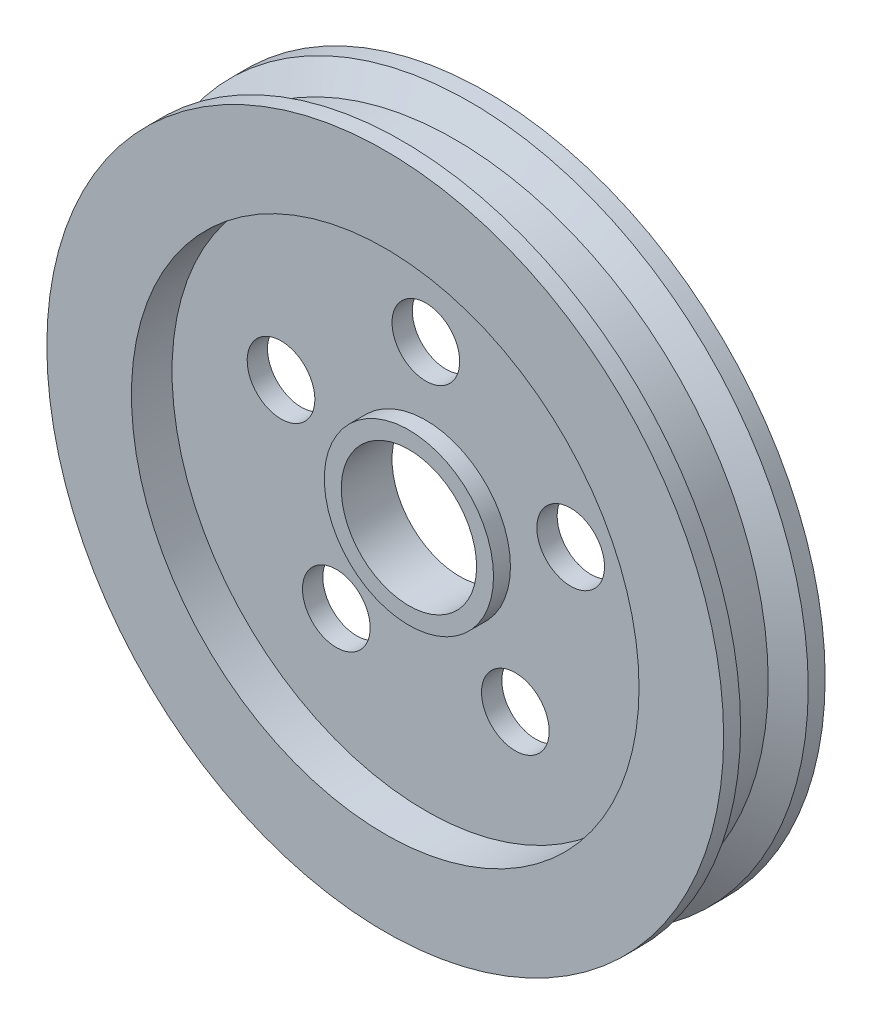
from build123d import *

# Parameters (mm, degrees)
SKETCH1_R                = 20
SKETCH1_R_2              = 4
BOSS_EXTRUDE1_DEPTH      = 3
SKETCH3_R                = 15
CUT_EXTRUDE1_DEPTH       = 2.4
SKETCH4_R                = 2
CUT_EXTRUDE2_DEPTH       = 29.51245342
CIRPATTERN1_COUNT        = 5
BOSS_EXTRUDE3_DEPTH      = 1
BOSS_EXTRUDE3_DEPTH_BACK = 2
SKETCH14_R               = 5
SKETCH16_R               = 4
CUT_EXTRUDE3_DEPTH       = 29.655889447


with BuildPart() as part:
    # Sketch1 → Boss-Extrude1 (new, symmetric)
    with BuildSketch(Plane.XY):
        Circle(SKETCH1_R)
        Circle(SKETCH1_R_2, mode=Mode.SUBTRACT)
    extrude(amount=BOSS_EXTRUDE1_DEPTH, both=True)

    # Sketch3 → Cut-Extrude1 (cut)
    with BuildSketch(Plane.XY.offset(3)):
        Circle(SKETCH3_R)
    cut_extrude1 = extrude(amount=-CUT_EXTRUDE1_DEPTH, mode=Mode.SUBTRACT)

    # Mirror1: Cut-Extrude1 across plane
    add(cut_extrude1.mirror(Plane.XY), mode=Mode.SUBTRACT)

    # Sketch4 → Cut-Extrude2 (cut, through all)
    with BuildSketch(Plane.XY.offset(0.6)):
        with Locations((0, 9)):
            Circle(SKETCH4_R)
    cut_extrude2 = extrude(amount=-CUT_EXTRUDE2_DEPTH, mode=Mode.SUBTRACT)

    # CirPattern1: Cut-Extrude2 ×5 about axis
    cirpattern1_axis = Axis((0, 0, 0), (0, 0, 1))
    for i in range(1, CIRPATTERN1_COUNT):
        add(cut_extrude2.rotate(cirpattern1_axis, i * 360 / CIRPATTERN1_COUNT), mode=Mode.SUBTRACT)

    # Sketch5 → Cut-Revolve1 (revolve, cut)
    with BuildSketch(Plane(origin=(0, 0, 0), x_dir=(1, 0, 0), z_dir=(0, 1, 0))):
        Polygon((20, 2), (18.5, 1.133974596), (18.5, -1.133974596), (20, -2), align=None)
    revolve(axis=Axis((0, 0, 0), (0, 0, -1)), mode=Mode.SUBTRACT)

    # Sketch14 → Boss-Extrude3 (add, two sides: drawn at the far end of the back side and taken through both)
    with BuildSketch(Plane.XY.offset(0.6).offset(-BOSS_EXTRUDE3_DEPTH_BACK)):
        Circle(SKETCH14_R)
    extrude(amount=BOSS_EXTRUDE3_DEPTH + BOSS_EXTRUDE3_DEPTH_BACK)

    # Sketch16 → Cut-Extrude3 (cut, through all)
    with BuildSketch(Plane.XY.offset(1.6)):
        Circle(SKETCH16_R)
    extrude(amount=-CUT_EXTRUDE3_DEPTH, mode=Mode.SUBTRACT)


solid = part.part
